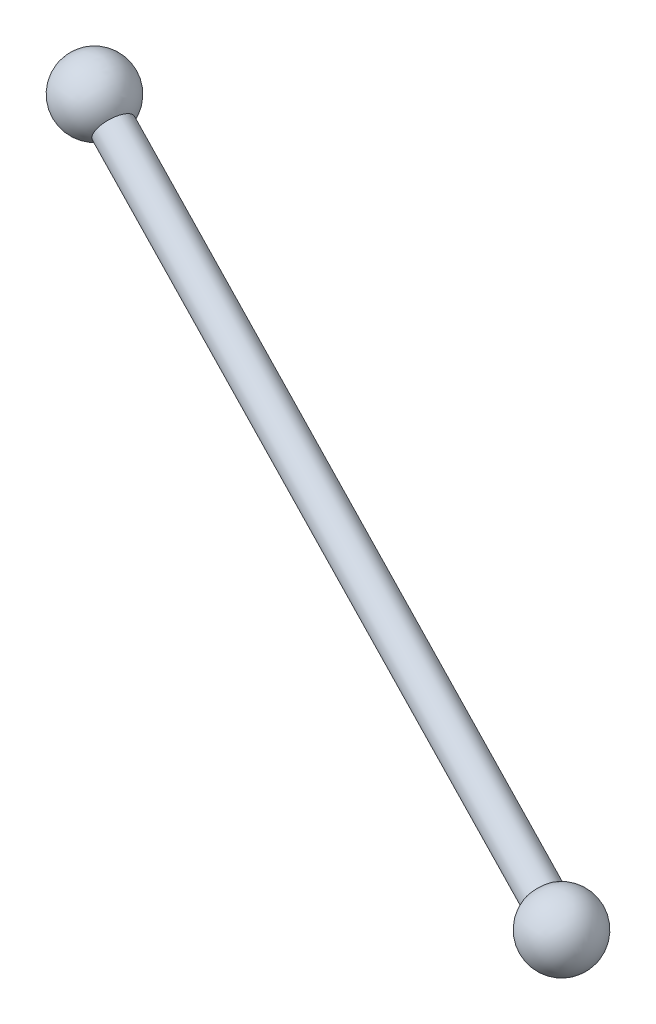
from build123d import *

# Parameters (mm, degrees)
THREE_MILLIMETRE_STRUT_CORE_SKETCH_R = 1.5
THREE_MILLIMETRE_STRUT_CORE_DEPTH    = 64.364941753


with BuildPart() as part:
    # Three millimetre strut core sketch → Three millimetre strut core (new body)
    with BuildSketch(Plane(origin=(-47.508082523, -23.76220438, -12.729752346), x_dir=(-0.20842845999452625, -0.1042500434014439, 0.9724656834640013), z_dir=(-0.8697399638531148, -0.4350194257638269, -0.23304612093938137))):
        with Locations(Location((13.090181548, -53.527480937, 0), (0, 0, 270))):
            Circle(THREE_MILLIMETRE_STRUT_CORE_SKETCH_R)
    extrude(amount=THREE_MILLIMETRE_STRUT_CORE_DEPTH)

    # Ball end 1 profile → Ball end 1 (revolve)
    with BuildSketch(Plane(origin=(0, -73, 0), x_dir=(-1, 0, 0), z_dir=(0, -1, 0))):
        with BuildLine():
            Line((26.291651246, -3), (26.291651246, 3))
            ThreePointArc((26.291651246, 3), (23.291651246, 0), (26.291651246, -3))
        make_face()
    revolve(axis=Axis((-26.291651246, -73, -10), (0, 0, 1)))

    # Ball end 2 profile → Ball end 2 (revolve)
    with BuildSketch(Plane(origin=(0, -101.000000001, 0), x_dir=(-1, 0, 0), z_dir=(0, -1, 0))):
        with BuildLine():
            Line((82.272413359, 12), (82.272413359, 18))
            ThreePointArc((82.272413359, 18), (79.272413359, 15), (82.272413359, 12))
        make_face()
    revolve(axis=Axis((-82.272413359, -101.000000001, -25), (0, 0, 1)))


with BuildPart() as body_2:
    # Mirror1: mirrored copy
    add(part.part.mirror(Plane(origin=(0, 0, 0), x_dir=(0, 0, 1), z_dir=(0, -1, 0))))


solid = body_2.part
